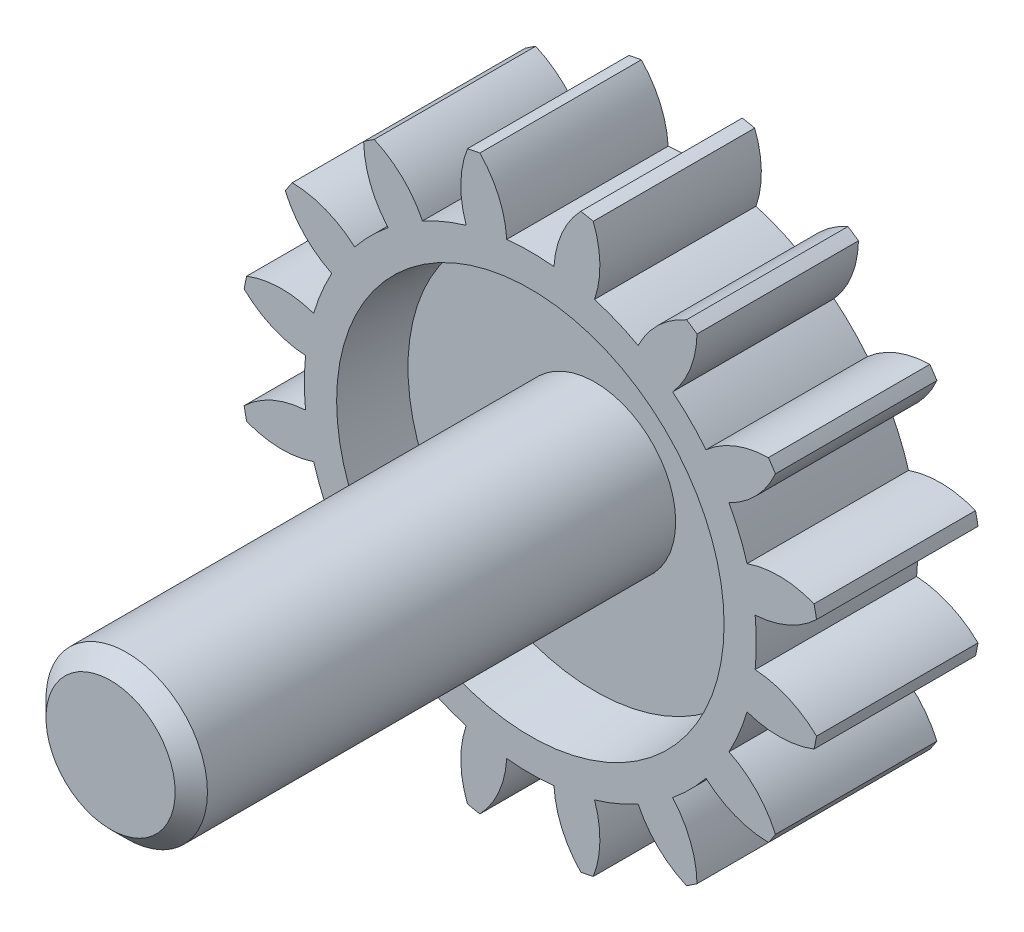
from build123d import *

# Parameters (mm, degrees)
SKETCH_1_R               = 18
EXTRUDE_1_DEPTH          = 10
CUT_EXTRUDE_4_DEPTH      = 10
PATTERN_CIRCULAR_1_COUNT = 16
SKETCH_6_R               = 12
CUT_EXTRUDE_5_DEPTH      = 4
CUT_EXTRUDE_5_DRAFT      = -6
SKETCH_7_R               = 12
CUT_EXTRUDE_6_DEPTH      = 4
CUT_EXTRUDE_6_DRAFT      = -6
SKETCH_10_R              = 5
EXTRUDE_2_DEPTH          = 30
CHAMFER_2_SIZE           = 1


with BuildPart() as part:
    # Эскиз1 → Бобышка-Вытянуть1 (new body)
    with BuildSketch(Plane.XY):
        Circle(SKETCH_1_R)
    extrude(amount=-EXTRUDE_1_DEPTH)

    # Эскиз5 → Вырез-Вытянуть4 (cut)
    with BuildSketch(Plane.XY):
        with BuildLine():
            ThreePointArc((1.463398486, 13.923306535), (0, 14), (-1.463398486, 13.923306535))
            ThreePointArc((-1.463398486, 13.923306535), (-1.955189123, 15.973239081), (-3.125667198, 17.726539554))
            ThreePointArc((-3.125667198, 17.726539554), (0, 18), (3.125667198, 17.726539554))
            ThreePointArc((3.125667198, 17.726539554), (1.955189123, 15.973239081), (1.463398486, 13.923306535))
        make_face()
    cut_extrude_4 = extrude(amount=-CUT_EXTRUDE_4_DEPTH, mode=Mode.SUBTRACT)

    # Круговой массив1: Вырез-Вытянуть4 ×16 about axis
    pattern_circular_1_axis = Axis((0, 0, 0), (0, 0, 1))
    for i in range(1, PATTERN_CIRCULAR_1_COUNT):
        add(cut_extrude_4.rotate(pattern_circular_1_axis, i * 360 / PATTERN_CIRCULAR_1_COUNT), mode=Mode.SUBTRACT)


with BuildPart() as cut_extrude_5_tool:
    # Эскиз6 → Вырез-Вытянуть5 (with draft: the straight prism first)
    with BuildSketch(Plane.XY):
        Circle(SKETCH_6_R)
    extrude(amount=-CUT_EXTRUDE_5_DEPTH)
    # Вырез-Вытянуть5: the draft: its side faces are tilted about the plane it starts from
    cut_extrude_5_sides = [cut_extrude_5_tool.faces().sort_by_distance(p)[0] for p in [
        (-12, 0, -2),
    ]]
    draft(cut_extrude_5_sides, Plane.XY, CUT_EXTRUDE_5_DRAFT)


with BuildPart() as part_1:
    add(part.part)

    # Вырез-Вытянуть5: cut by cut_extrude_5_tool
    add(cut_extrude_5_tool.part, mode=Mode.SUBTRACT)


with BuildPart() as cut_extrude_6_tool:
    # Эскиз7 → Вырез-Вытянуть6 (with draft: the straight prism first)
    with BuildSketch(Plane(origin=(0, 0, -10), x_dir=(-1, 0, 0), z_dir=(0, 0, -1))):
        Circle(SKETCH_7_R)
    extrude(amount=-CUT_EXTRUDE_6_DEPTH)
    # Вырез-Вытянуть6: the draft: its side faces are tilted about the plane it starts from
    cut_extrude_6_sides = [cut_extrude_6_tool.faces().sort_by_distance(p)[0] for p in [
        (12, 0, -8),
    ]]
    draft(cut_extrude_6_sides, Plane(origin=(0, 0, -10), x_dir=(-1, 0, 0), z_dir=(0, 0, -1)), CUT_EXTRUDE_6_DRAFT)


with BuildPart() as part_2:
    add(part_1.part)

    # Вырез-Вытянуть6: cut by cut_extrude_6_tool
    add(cut_extrude_6_tool.part, mode=Mode.SUBTRACT)

    # Эскиз10 → Бобышка-Вытянуть2 (add)
    with BuildSketch(Plane.XY.offset(-4)):
        Circle(SKETCH_10_R)
    extrude(amount=EXTRUDE_2_DEPTH)

    # Фаска2
    chamfer_2_edges = [part_2.edges().sort_by_distance(p)[0] for p in [
        (-5, 0, 26),
    ]]
    chamfer(chamfer_2_edges, length=CHAMFER_2_SIZE)


solid = part_2.part
